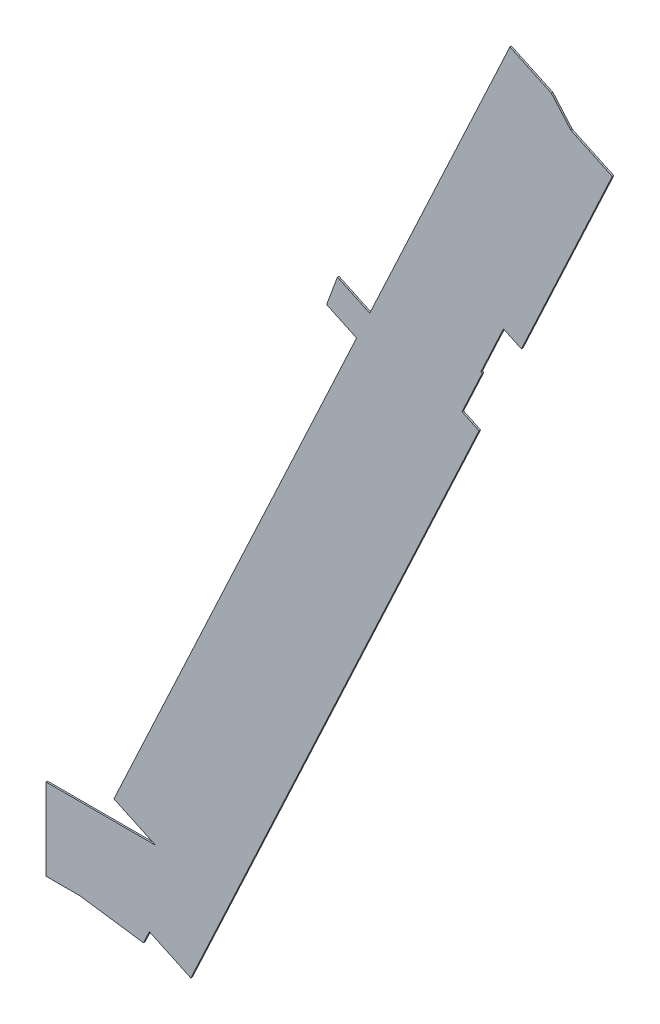
from build123d import *

# Parameters (mm, degrees)
EXTRUDE_1_DEPTH = 1
EXTRUDE_2_DEPTH = 2


with BuildPart() as part:
    # 草图1 → 拉伸1 (new body)
    with BuildSketch(Plane.XY.offset(49.5)):
        Polygon((1390.105050596, -579.075609045), (1377.377505434, -564.434243188), (1350.188271823, -551.755695336), (1258.268799894, -748.877639017), (1237.099840045, -739.006390924), (1239.746814184, -733.845622773), (1226.4, -727), (1213.4, -757.7), (1226.746814184, -764.545622773), (1230.039181278, -758.126541077), (1249.684280108, -767.287201107), (1198.420684959, -877.222335675), (1183.121903884, -910.030677565), (1170.274308727, -937.582434291), (1150.664821383, -979.63511561), (1135.45056396, -1012.262195943), (1122.349397846, -1040.357737342), (1107.895853295, -1071.353463658), (1090.610766389, -1108.421452148), (1117.8, -1121.1), (1046.2, -1121.1), (1046.2, -1174.6), (1068.2, -1174.6), (1110, -1180.474606891), (1113.845826182, -1172.227206029), (1141.035059793, -1184.905753881), (1329.933624158, -779.811475326), (1318.78530378, -774.612928158), (1332.080038523, -746.102277496), (1331.173730736, -745.679659234), (1345.965369897, -713.958886688), (1357.747371128, -719.45292409), (1417.294284207, -591.754156897), align=None)
    extrude(amount=-EXTRUDE_1_DEPTH)

    # 草图2 → 拉伸2 (cut)
    with BuildSketch(Plane.XY.offset(49.5)):
        Polygon((1239.746814184, -733.845622773), (1226.4, -727), (1213.4, -757.7), (1226.746814184, -764.545622773), (1230.039181278, -758.126541078), (1237.099840045, -739.006390924), align=None)
    extrude(amount=-EXTRUDE_2_DEPTH, mode=Mode.SUBTRACT)


solid = part.part
